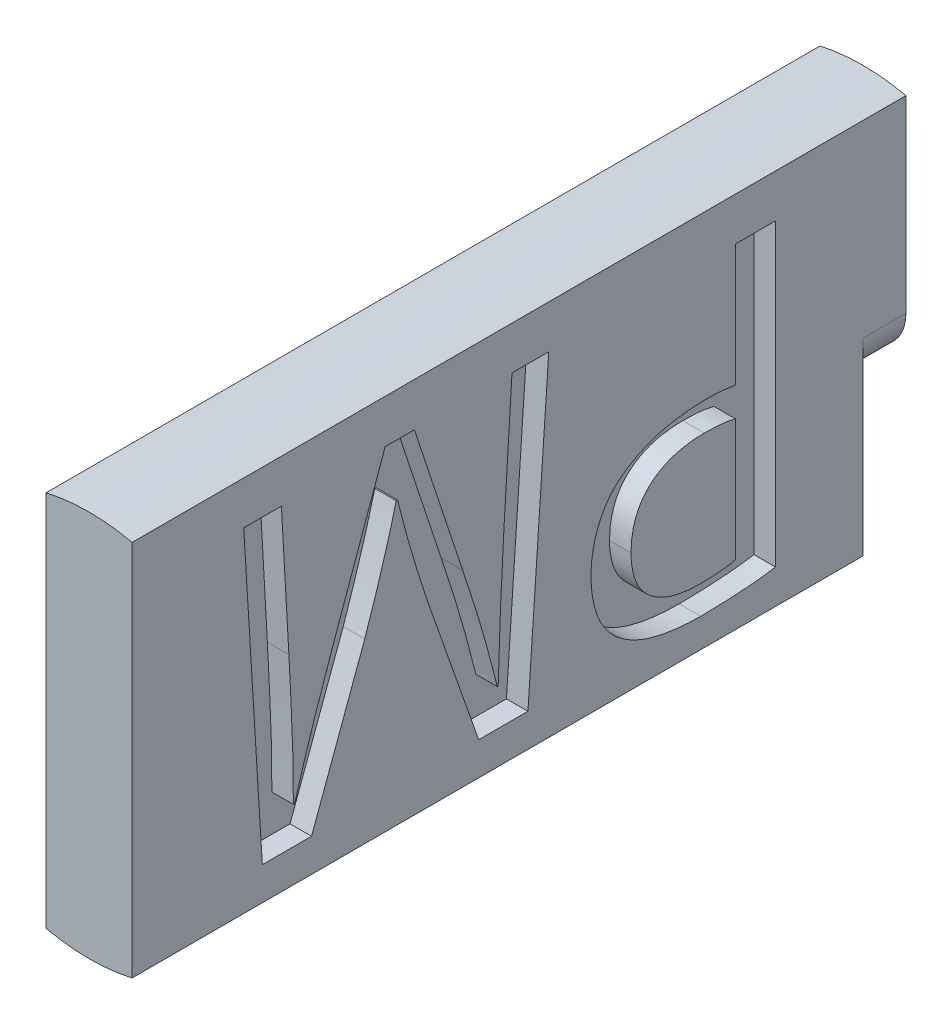
from build123d import *

# Parameters (mm, degrees)
BOSS_EXTRUDE1_DEPTH     = 17
BOSS_EXTRUDE6_START     = -1
BOSS_EXTRUDE6_DEPTH     = 1
CUT_EXTRUDE1_DEPTH      = 0.5
CUT_EXTRUDE2_DEPTH      = 0.5
CUT_EXTRUDE3_DEPTH      = 18.613915056
CUT_EXTRUDE3_DEPTH_BACK = 4
SKETCH6_R               = 0.275


with BuildPart() as part:
    # Sketch1 → Boss-Extrude1 (new body)
    with BuildSketch(Plane.XY):
        with BuildLine():
            Line((-1, 4.387482194), (-1, -4.387482194))
            ThreePointArc((-1, -4.387482194), (0, -4.5), (1, -4.387482194))
            Line((1, -4.387482194), (1, 4.387482194))
            ThreePointArc((1, 4.387482194), (0, 4.5), (-1, 4.387482194))
        make_face()
    extrude(amount=BOSS_EXTRUDE1_DEPTH)

    # Sketch3 → Boss-Extrude6 (add)
    with BuildSketch(Plane.XY.offset(BOSS_EXTRUDE6_START)):
        with BuildLine():
            Line((-1, 4.387482194), (-1, 0))
            ThreePointArc((-1, 0), (0, -1), (1, 0))
            Line((1, 0), (1, 4.387482194))
            ThreePointArc((1, 4.387482194), (0, 4.5), (-1, 4.387482194))
        make_face()
    extrude(amount=BOSS_EXTRUDE6_DEPTH)

    # Sketch4 → Cut-Extrude1 (cut)
    # profile 1 of 2: a face of its own
    with BuildSketch(Plane.ZY.offset(1)):
        Polygon((5.681090157, -1.172217793), (6.427602673, -3.381480229), (7.391507968, -3.381480229), (5.007155247, 3.618519771), (3.918491161, 3.618519771), (1.54416663, -3.381480229), (2.477307275, -3.381480229), (3.203083333, -1.172217793), align=None)
        with BuildLine():
            Line((3.389711462, -0.511838969), (4.074014602, 1.532258774))
            add(Edge.make_bspline(
                [(4.074014602, 1.532258774), (4.137336986, 1.758624097), (4.26074284, 2.199776243), (4.371762052, 2.644205674), (4.425814751, 2.860588132)],
                knots=[0, 0, 0, 0, 1.026246043, 2, 2, 2, 2], degree=3))
            Line((4.425814751, 2.860588132), (4.44727086, 2.862086058))
            add(Edge.make_bspline(
                [(4.44727086, 2.862086058), (4.472139274, 2.757402563), (4.522616207, 2.544920101), (4.60922491, 2.222332927), (4.704851234, 1.890099823), (4.774603753, 1.665781832), (4.810034305, 1.551840276)],
                knots=[0, 0, 0, 0, 0.949425508, 1.927106746, 2.947080969, 4, 4, 4, 4], degree=3))
            Line((4.810034305, 1.551840276), (5.494462028, -0.511838969))
            Line((5.494462028, -0.511838969), (3.389711462, -0.511838969))
        make_face(mode=Mode.SUBTRACT)
    # profile 2 of 2: a face of its own
    with BuildSketch(Plane.ZY.offset(1)):
        with BuildLine():
            Line((14.391295444, -3.381480229), (15.268008826, -3.381480229))
            Line((15.268008826, -3.381480229), (14.834797409, 3.618519771))
            Line((14.834797409, 3.618519771), (13.6899435, 3.618519771))
            Line((13.6899435, 3.618519771), (12.452263598, 0.262877652))
            add(Edge.make_bspline(
                [(12.452263598, 0.262877652), (12.41336996, 0.151363495), (12.336858294, -0.068007442), (12.231030286, -0.394374299), (12.130484293, -0.71056495), (12.035659344, -1.017170781), (11.947029376, -1.314335921), (11.86458447, -1.602543732), (11.787548011, -1.880966579), (11.741174561, -2.064141609), (11.71848199, -2.153777219)],
                knots=[0, 0, 0, 0, 1.121916709, 2.207037457, 3.259184783, 4.273902362, 5.255812734, 6.2050194, 7.121636937, 8, 8, 8, 8], degree=3))
            Line((11.71848199, -2.153777219), (11.689027659, -2.153777219))
            add(Edge.make_bspline(
                [(11.689027659, -2.153777219), (11.641491952, -1.966992526), (11.543871387, -1.583406613), (11.380534797, -0.996999688), (11.193630198, -0.385379803), (11.057365844, 0.029215034), (10.987564322, 0.241591563)],
                knots=[0, 0, 0, 0, 0.926374355, 1.902426502, 2.925516341, 4, 4, 4, 4], degree=3))
            Line((10.987564322, 0.241591563), (9.801565808, 3.618519771))
            Line((9.801565808, 3.618519771), (8.656711899, 3.618519771))
            Line((8.656711899, 3.618519771), (8.171953937, -3.381480229))
            Line((8.171953937, -3.381480229), (9.02801587, -3.381480229))
            Line((9.02801587, -3.381480229), (9.213667855, -0.354987621))
            add(Edge.make_bspline(
                [(9.213667855, -0.354987621), (9.228434804, -0.085102935), (9.258087711, 0.456841479), (9.290555686, 1.132511853), (9.312909666, 1.665856236), (9.325837813, 2.048616089), (9.338551083, 2.412790105), (9.344321372, 2.649461711), (9.34712693, 2.764533244)],
                knots=[0, 0, 0, 0, 1.558100319, 3.128757611, 3.89942431, 4.635288355, 5.336466831, 6, 6, 6, 6], degree=3))
            Line((9.34712693, 2.764533244), (9.368377843, 2.76603117))
            add(Edge.make_bspline(
                [(9.368377843, 2.76603117), (9.421618863, 2.551589289), (9.530849452, 2.111635037), (9.722446457, 1.440891205), (9.934431348, 0.739336462), (10.091940163, 0.264251217), (10.172598628, 0.020965491)],
                knots=[0, 0, 0, 0, 0.92658189, 1.900998255, 2.925125187, 4, 4, 4, 4], degree=3))
            Line((10.172598628, 0.020965491), (11.29709569, -3.372473617))
            Line((11.29709569, -3.372473617), (11.977819636, -3.372473617))
            Line((11.977819636, -3.372473617), (13.205185538, 0.063256258))
            add(Edge.make_bspline(
                [(13.205185538, 0.063256258), (13.28890308, 0.302144685), (13.452725919, 0.769613983), (13.685344275, 1.457934013), (13.891904702, 2.120100126), (14.018886603, 2.553237025), (14.080831904, 2.764533244)],
                knots=[0, 0, 0, 0, 1.069530785, 2.09291347, 3.069670184, 4, 4, 4, 4], degree=3))
            Line((14.080831904, 2.764533244), (14.112817467, 2.76603117))
            add(Edge.make_bspline(
                [(14.112817467, 2.76603117), (14.11230881, 2.649464074), (14.11126744, 2.410816573), (14.116477668, 2.044587628), (14.124832856, 1.661810086), (14.146055094, 1.134020108), (14.175589544, 0.475616188), (14.20262255, -0.049588003), (14.215909091, -0.307722331)],
                knots=[0, 0, 0, 0, 0.682122847, 1.396508258, 2.143249769, 2.922538225, 4.487448233, 6, 6, 6, 6], degree=3))
            Line((14.215909091, -0.307722331), (14.391295444, -3.381480229))
        make_face()
    extrude(amount=-CUT_EXTRUDE1_DEPTH, mode=Mode.SUBTRACT)

    # Sketch5 → Cut-Extrude2 (cut)
    # profile 1 of 2: a face of its own
    with BuildSketch(Plane(origin=(1, 0, 1), x_dir=(0, 0, -1), z_dir=(1, 0, 0))):
        with BuildLine():
            Line((-1.033446219, 3.381480229), (-1.963979417, 3.381480229))
            Line((-1.963979417, 3.381480229), (-1.963979417, 0.53928092))
            add(Edge.make_bspline(
                [(-1.963979417, 0.53928092), (-2.017429281, 0.54865419), (-2.127424999, 0.567943661), (-2.298707786, 0.587700789), (-2.481188749, 0.595874417), (-2.606341819, 0.595882717), (-2.670883362, 0.595886996)],
                knots=[0, 0, 0, 0, 0.916506777, 1.886100572, 2.909860303, 4, 4, 4, 4], degree=3))
            add(Edge.make_bspline(
                [(-2.670883362, 0.595886996), (-2.776522323, 0.593387502), (-2.98431668, 0.588470936), (-3.289082406, 0.555531055), (-3.580463873, 0.499384215), (-3.857710879, 0.424170429), (-4.118227827, 0.325725596), (-4.357699858, 0.20320174), (-4.578015629, 0.06186703), (-4.706857248, -0.051796485), (-4.77058319, -0.108015233)],
                knots=[0, 0, 0, 0, 1.118417172, 2.199953256, 3.240842043, 4.25729367, 5.238050899, 6.183220205, 7.101408346, 8, 8, 8, 8], degree=3))
            add(Edge.make_bspline(
                [(-4.77058319, -0.108015233), (-4.814744066, -0.156610003), (-4.903183784, -0.253929353), (-5.015782702, -0.417406199), (-5.110249563, -0.594029646), (-5.189054304, -0.783406418), (-5.250384674, -0.986026493), (-5.293157709, -1.202220602), (-5.321190328, -1.431038664), (-5.324303861, -1.588274781), (-5.325900515, -1.668907172)],
                knots=[0, 0, 0, 0, 0.926711229, 1.855897998, 2.794948255, 3.75167401, 4.748708266, 5.77982043, 6.861467772, 8, 8, 8, 8], degree=3))
            add(Edge.make_bspline(
                [(-5.325900515, -1.668907172), (-5.322965523, -1.74958199), (-5.317271122, -1.906105384), (-5.283027361, -2.133064952), (-5.23268358, -2.345295988), (-5.163847898, -2.543473867), (-5.075261038, -2.725978598), (-4.966984546, -2.892425053), (-4.842886987, -3.046452952), (-4.744848152, -3.134491614), (-4.695540309, -3.17876995)],
                knots=[0, 0, 0, 0, 1.146385194, 2.224189708, 3.255333176, 4.242400818, 5.199441181, 6.13021738, 7.059607867, 8, 8, 8, 8], degree=3))
            add(Edge.make_bspline(
                [(-4.695540309, -3.17876995), (-4.640974544, -3.221209888), (-4.52902899, -3.308278441), (-4.338327745, -3.414553171), (-4.127972151, -3.507134363), (-3.896324636, -3.581001346), (-3.644368593, -3.639633611), (-3.371800496, -3.680345907), (-3.078677848, -3.708202258), (-2.876069344, -3.712405526), (-2.771440823, -3.714576125)],
                knots=[0, 0, 0, 0, 0.813924776, 1.669824652, 2.56509431, 3.520036309, 4.531479028, 5.611687746, 6.766658007, 8, 8, 8, 8], degree=3))
            add(Edge.make_bspline(
                [(-2.771440823, -3.714576125), (-2.684886439, -3.71331023), (-2.515754707, -3.710836605), (-2.268589654, -3.703285923), (-2.033421775, -3.692878913), (-1.810279558, -3.679282155), (-1.598479974, -3.663665612), (-1.399543012, -3.641590433), (-1.212082881, -3.620410722), (-1.091918038, -3.600966875), (-1.033447684, -3.591505799)],
                knots=[0, 0, 0, 0, 1.191255629, 2.32777496, 3.402890041, 4.430600222, 5.404311691, 6.325053885, 7.184997136, 8, 8, 8, 8], degree=3))
            Line((-1.033447684, -3.591505799), (-1.033446219, 3.381480229))
        make_face()
        with BuildLine():
            add(Edge.make_bspline(
                [(-1.963979417, -2.978527108), (-2.010818782, -2.990272554), (-2.118341261, -3.017234907), (-2.304875334, -3.035268749), (-2.5340165, -3.051246626), (-2.701350452, -3.053158096), (-2.79245283, -3.054198767)],
                knots=[0, 0, 0, 0, 0.693984813, 1.593082401, 2.689591003, 4, 4, 4, 4], degree=3))
            add(Edge.make_bspline(
                [(-2.79245283, -3.054198767), (-2.852022225, -3.053580565), (-2.968406843, -3.052372744), (-3.138580073, -3.035769648), (-3.298820268, -3.006785506), (-3.450346616, -2.970016549), (-3.591812681, -2.920697986), (-3.723137712, -2.858503166), (-3.845230887, -2.786162941), (-3.958604329, -2.704141295), (-4.059405052, -2.609274822), (-4.147465374, -2.50281371), (-4.223064741, -2.385140206), (-4.284684832, -2.254926898), (-4.332558963, -2.113308311), (-4.366452148, -1.960282877), (-4.389673737, -1.796664607), (-4.393436454, -1.68349838), (-4.395368782, -1.6253823)],
                knots=[0, 0, 0, 0, 1.170518191, 2.286917866, 3.3555253, 4.369104552, 5.348726486, 6.294449829, 7.220282735, 8.134819768, 9.039150069, 9.933048956, 10.844090323, 11.780928133, 12.757336967, 13.77591218, 14.857828265, 16, 16, 16, 16], degree=3))
            add(Edge.make_bspline(
                [(-4.395368782, -1.6253823), (-4.393256908, -1.563790027), (-4.389158302, -1.444255222), (-4.368453186, -1.270329994), (-4.333134197, -1.107600427), (-4.280893318, -0.956928572), (-4.218991059, -0.815834396), (-4.139537028, -0.68759949), (-4.048078845, -0.569680763), (-3.942182433, -0.464444604), (-3.824418031, -0.370774084), (-3.694745918, -0.289814979), (-3.554394046, -0.220709688), (-3.403401038, -0.162959609), (-3.24068098, -0.120319625), (-3.067082514, -0.088832533), (-2.882444536, -0.069203051), (-2.755480312, -0.066087494), (-2.690394511, -0.064490362)],
                knots=[0, 0, 0, 0, 1.126305995, 2.18587105, 3.197743792, 4.163771185, 5.097075175, 6.008430937, 6.914078009, 7.819494137, 8.730804004, 9.659570714, 10.608518257, 11.586935534, 12.60970331, 13.678895792, 14.810129967, 16, 16, 16, 16], degree=3))
            add(Edge.make_bspline(
                [(-2.690394511, -0.064490362), (-2.620326863, -0.06527252), (-2.486553069, -0.066765823), (-2.295115943, -0.080179958), (-2.122152618, -0.102431181), (-2.014831928, -0.128623305), (-1.963979417, -0.141034101)],
                knots=[0, 0, 0, 0, 1.147758949, 2.191311855, 3.142976682, 4, 4, 4, 4], degree=3))
            Line((-1.963979417, -0.141034101), (-1.963979417, -2.978527108))
        make_face(mode=Mode.SUBTRACT)
    # profile 2 of 2: a face of its own
    with BuildSketch(Plane(origin=(1, 0, 1), x_dir=(0, 0, -1), z_dir=(1, 0, 0))):
        with BuildLine():
            Line((-12.526801448, 3.381480229), (-13.403514829, 3.381480229))
            Line((-13.403514829, 3.381480229), (-12.970303413, -3.618519771))
            Line((-12.970303413, -3.618519771), (-11.825449504, -3.618519771))
            Line((-11.825449504, -3.618519771), (-10.587769602, -0.262877652))
            add(Edge.make_bspline(
                [(-10.587769602, -0.262877652), (-10.549476669, -0.151829974), (-10.473946313, 0.067204459), (-10.367780831, 0.392792659), (-10.26817066, 0.709428776), (-10.169955812, 1.015502784), (-10.08483344, 1.314221209), (-10.001704703, 1.602069853), (-9.924127233, 1.880353855), (-9.878119966, 2.06362539), (-9.855488851, 2.153777219)],
                knots=[0, 0, 0, 0, 1.116072626, 2.201381783, 3.253711794, 4.270018324, 5.255314989, 6.204686465, 7.116879767, 8, 8, 8, 8], degree=3))
            Line((-9.855488851, 2.153777219), (-9.824533662, 2.153777219))
            add(Edge.make_bspline(
                [(-9.824533662, 2.153777219), (-9.777706978, 1.966437206), (-9.681751366, 1.582546573), (-9.516841557, 0.996198315), (-9.331011548, 0.384268011), (-9.19444888, -0.030738107), (-9.124571184, -0.24309242)],
                knots=[0, 0, 0, 0, 0.927707689, 1.9010263, 2.925976995, 4, 4, 4, 4], degree=3))
            Line((-9.124571184, -0.24309242), (-7.937071812, -3.618519771))
            Line((-7.937071812, -3.618519771), (-6.792217902, -3.618519771))
            Line((-6.792217902, -3.618519771), (-6.307459941, 3.381480229))
            Line((-6.307459941, 3.381480229), (-7.163521873, 3.381480229))
            Line((-7.163521873, 3.381480229), (-7.349173858, 0.354987621))
            add(Edge.make_bspline(
                [(-7.349173858, 0.354987621), (-7.364585663, 0.085110761), (-7.395560403, -0.457289426), (-7.427478458, -1.133516787), (-7.449927688, -1.6673565), (-7.462841904, -2.050117094), (-7.47555858, -2.414290929), (-7.481328441, -2.650962558), (-7.484133791, -2.766034101)],
                knots=[0, 0, 0, 0, 1.557468842, 3.130210542, 3.900487261, 4.635978938, 5.336802598, 6, 6, 6, 6], degree=3))
            Line((-7.484133791, -2.766034101), (-7.503883846, -2.76603117))
            add(Edge.make_bspline(
                [(-7.503883846, -2.76603117), (-7.558013536, -2.552195792), (-7.669245491, -2.112782092), (-7.856339784, -1.441132406), (-8.07240739, -0.740779506), (-8.229239961, -0.265839361), (-8.309605489, -0.022466348)],
                knots=[0, 0, 0, 0, 0.925405201, 1.901629775, 2.924734645, 4, 4, 4, 4], degree=3))
            Line((-8.309605489, -0.022466348), (-9.432601693, 3.372473617))
            Line((-9.432601693, 3.372473617), (-10.113325639, 3.372473617))
            Line((-10.113325639, 3.372473617), (-11.340691542, -0.063256258))
            add(Edge.make_bspline(
                [(-11.340691542, -0.063256258), (-11.425202529, -0.3025467), (-11.590322141, -0.770078156), (-11.819918757, -1.460062046), (-12.029422476, -2.121280836), (-12.156074769, -2.554680091), (-12.217838765, -2.766034101)],
                knots=[0, 0, 0, 0, 1.071511762, 2.093545618, 3.070287326, 4, 4, 4, 4], degree=3))
            Line((-12.217838765, -2.766034101), (-12.24832347, -2.76603117))
            add(Edge.make_bspline(
                [(-12.24832347, -2.76603117), (-12.248446787, -2.649964428), (-12.248699808, -2.411817774), (-12.253377514, -2.046089015), (-12.2618182, -1.663308465), (-12.283350014, -1.135556912), (-12.310145019, -0.477024126), (-12.338820731, 0.048101792), (-12.352915952, 0.306221473)],
                knots=[0, 0, 0, 0, 0.679526504, 1.394257817, 2.141360897, 2.921026681, 4.486565637, 6, 6, 6, 6], degree=3))
            Line((-12.352915952, 0.306221473), (-12.526801448, 3.381480229))
        make_face()
    extrude(amount=-CUT_EXTRUDE2_DEPTH, mode=Mode.SUBTRACT)

    # Sketch6 → Cut-Extrude3 (cut, two sides: drawn at the far end of the back side and taken through both)
    with BuildSketch(Plane(origin=(0, 0, 0), x_dir=(-1, 0, 0), z_dir=(0, 0, -1)).offset(-CUT_EXTRUDE3_DEPTH_BACK)):
        Circle(SKETCH6_R)
    extrude(amount=CUT_EXTRUDE3_DEPTH + CUT_EXTRUDE3_DEPTH_BACK, mode=Mode.SUBTRACT)


solid = part.part
